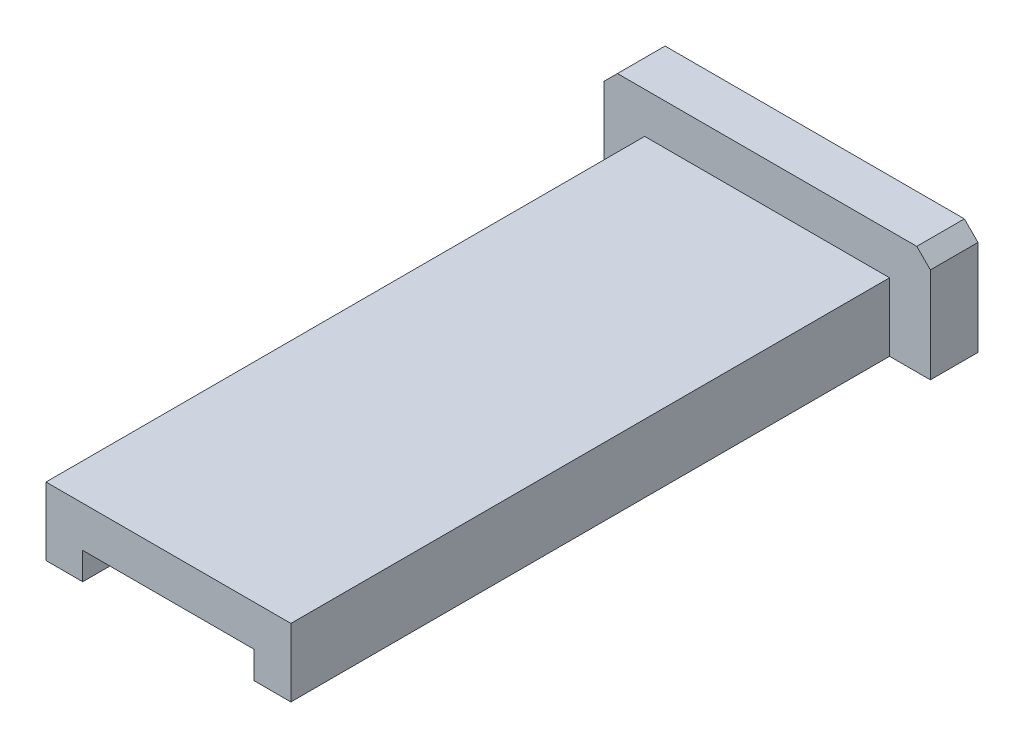
from build123d import *

# Parameters (mm, degrees)
SKETCH_1_W          = 18
SKETCH_1_H          = 5
EXTRUDE_1_DEPTH     = 47.5
SKETCH_2_W          = 24
SKETCH_2_H          = 8
EXTRUDE_2_DEPTH     = 3.5
SKETCH_3_W          = 12.6
SKETCH_3_H          = 2
CUT_EXTRUDE_1_DEPTH = 50.30010142
CHAMFER_1_SIZE      = 1


with BuildPart() as part:
    # 草图1 → 凸台-拉伸1 (new body)
    with BuildSketch(Plane.XY):
        Rectangle(SKETCH_1_W, SKETCH_1_H)
    extrude(amount=EXTRUDE_1_DEPTH)

    # 草图2 → 凸台-拉伸2 (add)
    with BuildSketch(Plane(origin=(0, 0, 0), x_dir=(-1, 0, 0), z_dir=(0, 0, -1))):
        with Locations((0, 1.5)):
            Rectangle(SKETCH_2_W, SKETCH_2_H)
    extrude(amount=-EXTRUDE_2_DEPTH)

    # 草图3 → 切除-拉伸1 (cut, through all)
    with BuildSketch(Plane(origin=(0, 0, 0), x_dir=(-1, 0, 0), z_dir=(0, 0, -1))):
        with Locations((0, -1.5)):
            Rectangle(SKETCH_3_W, SKETCH_3_H)
    extrude(amount=-CUT_EXTRUDE_1_DEPTH, mode=Mode.SUBTRACT)

    # 倒角1
    chamfer_1_edges = [part.edges().sort_by_distance(p)[0] for p in [
        (12, 5.5, 1.75),
        (-12, 5.5, 1.75),
    ]]
    chamfer(chamfer_1_edges, length=CHAMFER_1_SIZE)


solid = part.part
